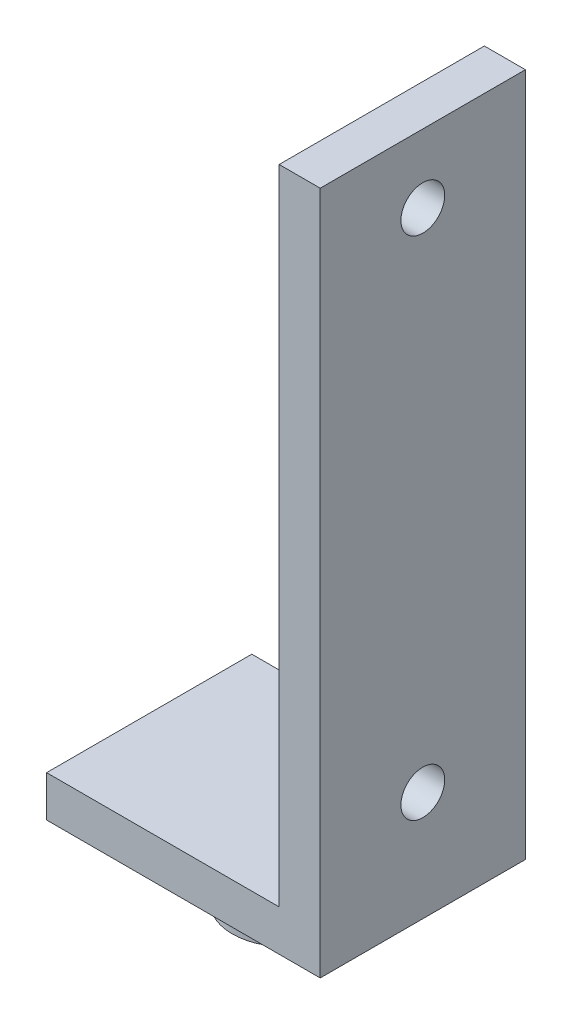
from build123d import *

# Parameters (mm, degrees)
SKETCH1_R                      = 3.925
SKETCH1_R_2                    = 2.924999992
BOSS_EXTRUDE1_DEPTH            = 4
SKETCH1_R_3                    = 0.875
BOSS_EXTRUDE1_2_DEPTH          = 4
SKETCH2_W                      = 20
SKETCH2_H                      = 15
BOSS_EXTRUDE2_DEPTH            = 3
BOSS_EXTRUDE3_START            = 10
SKETCH3_W                      = 15
SKETCH3_H                      = 50
BOSS_EXTRUDE3_DEPTH            = 3
F_3_2_3_2_DIAMETER_HOLE1_D     = 3.2
F_3_2_3_2_DIAMETER_HOLE1_DEPTH = 4
F_3_2_3_2_DIAMETER_HOLE1_TIP   = 0.96137699


with BuildPart() as part:
    # Sketch1 → Boss-Extrude1 (new body)
    with BuildSketch(Plane(origin=(0, 0, 0), x_dir=(1, 0, 0), z_dir=(0, 1, 0))):
        with Locations(Location((0, 0, 0), (0, 0, 270))):
            Circle(SKETCH1_R)
        with Locations(Location((0, 0, 0), (0, 0, 270))):
            Circle(SKETCH1_R_2, mode=Mode.SUBTRACT)
    extrude(amount=BOSS_EXTRUDE1_DEPTH)



with BuildPart() as body_2:
    # Sketch1 → Boss-Extrude1 2 (new body)
    with BuildSketch(Plane(origin=(0, 0, 0), x_dir=(1, 0, 0), z_dir=(0, 1, 0))):
        with Locations(Location((0, 0, 0), (0, 0, 270))):
            Circle(SKETCH1_R_3)
    extrude(amount=BOSS_EXTRUDE1_2_DEPTH)


with BuildPart() as part_1:
    add(part.part)

    add(body_2.part)  # Boss-Extrude2 merges body 2
    # Sketch2 → Boss-Extrude2 (add)
    with BuildSketch(Plane(origin=(0, 4, 0), x_dir=(1, 0, 0), z_dir=(0, 1, 0))):
        Rectangle(SKETCH2_W, SKETCH2_H)
    extrude(amount=BOSS_EXTRUDE2_DEPTH)

    # Sketch3 → Boss-Extrude3 (add)
    with BuildSketch(Plane(origin=(0, 0, 0), x_dir=(0, 0, -1), z_dir=(1, 0, 0)).offset(BOSS_EXTRUDE3_START)):
        with Locations((0, 29)):
            Rectangle(SKETCH3_W, SKETCH3_H)
    extrude(amount=-BOSS_EXTRUDE3_DEPTH)

    # Ø3.2 (3.2) Diameter Hole1
    with Locations(Plane(origin=(10, 0, 0), x_dir=(0, 0, -1), z_dir=(1, 0, 0))):
        with Locations((0, 12), (0, 49)):
            Hole(F_3_2_3_2_DIAMETER_HOLE1_D / 2, depth=F_3_2_3_2_DIAMETER_HOLE1_DEPTH)
            with Locations((0, 0, -(F_3_2_3_2_DIAMETER_HOLE1_DEPTH + F_3_2_3_2_DIAMETER_HOLE1_TIP / 2))):  # 118° drill point
                Cone(0, F_3_2_3_2_DIAMETER_HOLE1_D / 2, F_3_2_3_2_DIAMETER_HOLE1_TIP, mode=Mode.SUBTRACT)


solid = part_1.part
